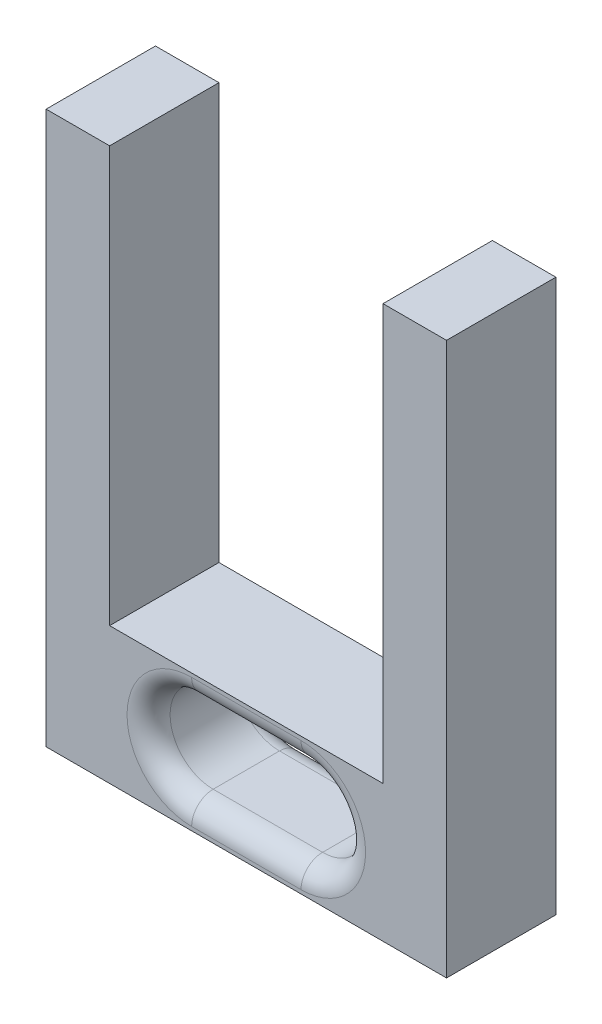
from build123d import *

# Parameters (mm, degrees)
BOSS_EXTRUDE1_DEPTH = 25.4
FILLET1_R           = 5


with BuildPart() as part:
    # Sketch1 → Boss-Extrude1 (new body)
    with BuildSketch(Plane.XY):
        Polygon((-46.5, 0), (-31.75, 0), (-31.75, -96.52), (31.75, -96.52), (31.75, 0), (46.5, 0), (46.5, -128.27), (-46.5, -128.27), align=None)
        with BuildLine():
            Line((-12.7, -102.395), (12.7, -102.395))
            ThreePointArc((12.7, -102.395), (22.7, -112.395), (12.7, -122.395))
            Line((12.7, -122.395), (-12.7, -122.395))
            ThreePointArc((-12.7, -122.395), (-22.7, -112.395), (-12.7, -102.395))
        make_face(mode=Mode.SUBTRACT)
    extrude(amount=BOSS_EXTRUDE1_DEPTH)

    # Fillet1
    fillet1_edges = [part.edges().sort_by_distance(p)[0] for p in [
        (22.7, -112.395, 0),
        (0, -122.395, 0),
        (-22.7, -112.395, 0),
        (-22.7, -112.395, 25.4),
        (0, -102.395, 25.4),
        (22.7, -112.395, 25.4),
        (0, -102.395, 0),
        (0, -122.395, 25.4),
    ]]
    fillet(fillet1_edges, radius=FILLET1_R)


solid = part.part
